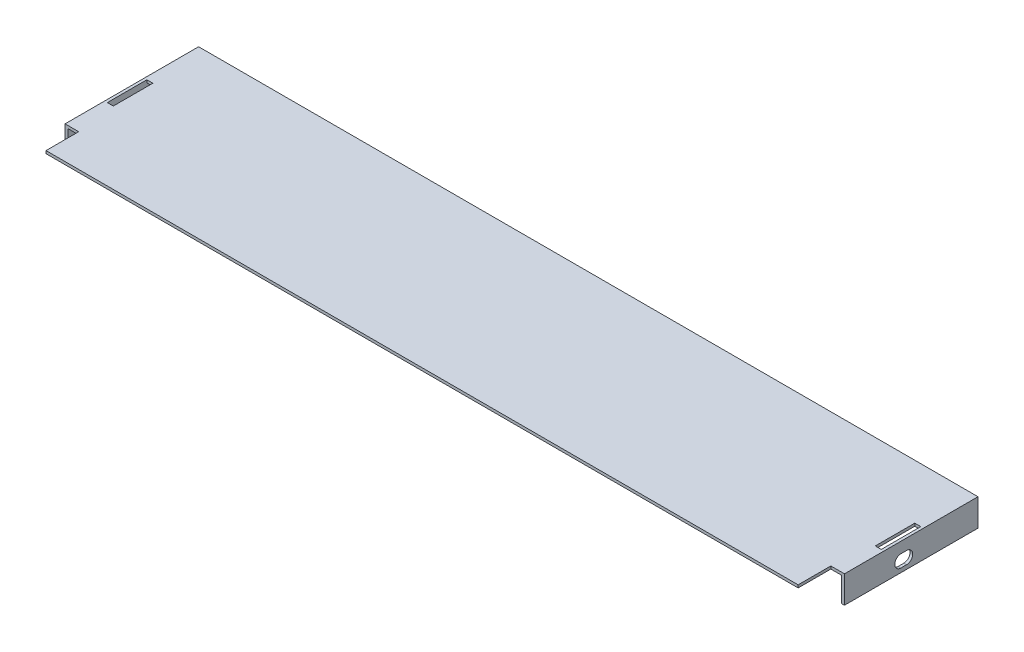
from build123d import *

# Parameters (mm, degrees)
SKETCH_1_W          = 2.2
SKETCH_1_H          = 14.5
EXTRUDE_1_DEPTH     = 1
EXTRUDE_2_DEPTH     = 9
CUT_EXTRUDE_1_DEPTH = 288.762488869


with BuildPart() as part:
    # Эскиз1 → Бобышка-Вытянуть1 (new body)
    with BuildSketch(Plane(origin=(0, 0, 0), x_dir=(1, 0, 0), z_dir=(0, 1, 0))):
        Polygon((138, -30.5), (138, -18.5), (143, -18.5), (143, 30.5), (-143, 30.5), (-143, -18.5), (-138, -18.5), (-138, -30.5), align=None)
        with Locations((140.9, 3.25)):
            Rectangle(SKETCH_1_W, SKETCH_1_H, mode=Mode.SUBTRACT)
        with Locations((-140.9, 3.25)):
            Rectangle(SKETCH_1_W, SKETCH_1_H, mode=Mode.SUBTRACT)
    extrude(amount=EXTRUDE_1_DEPTH)

    # Эскиз2 → Бобышка-Вытянуть2 (add)
    with BuildSketch(Plane.XZ):
        Polygon((-143, 18.5), (-143, -30.5), (143, -30.5), (143, 18.5), (142, 18.5), (142, -29.5), (-142, -29.5), (-142, 18.5), align=None)
    extrude(amount=EXTRUDE_2_DEPTH)

    # Эскиз3 → Вырез-Вытянуть1 (cut, through all)
    with BuildSketch(Plane(origin=(143, 0, 0), x_dir=(0, 0, -1), z_dir=(1, 0, 0))):
        with BuildLine():
            Line((2.2, -3), (4.3, -3))
            ThreePointArc((4.3, -3), (6.55, -5.25), (4.3, -7.5))
            Line((4.3, -7.5), (2.2, -7.5))
            ThreePointArc((2.2, -7.5), (-0.05, -5.25), (2.2, -3))
        make_face()
    extrude(amount=-CUT_EXTRUDE_1_DEPTH, mode=Mode.SUBTRACT)


solid = part.part
